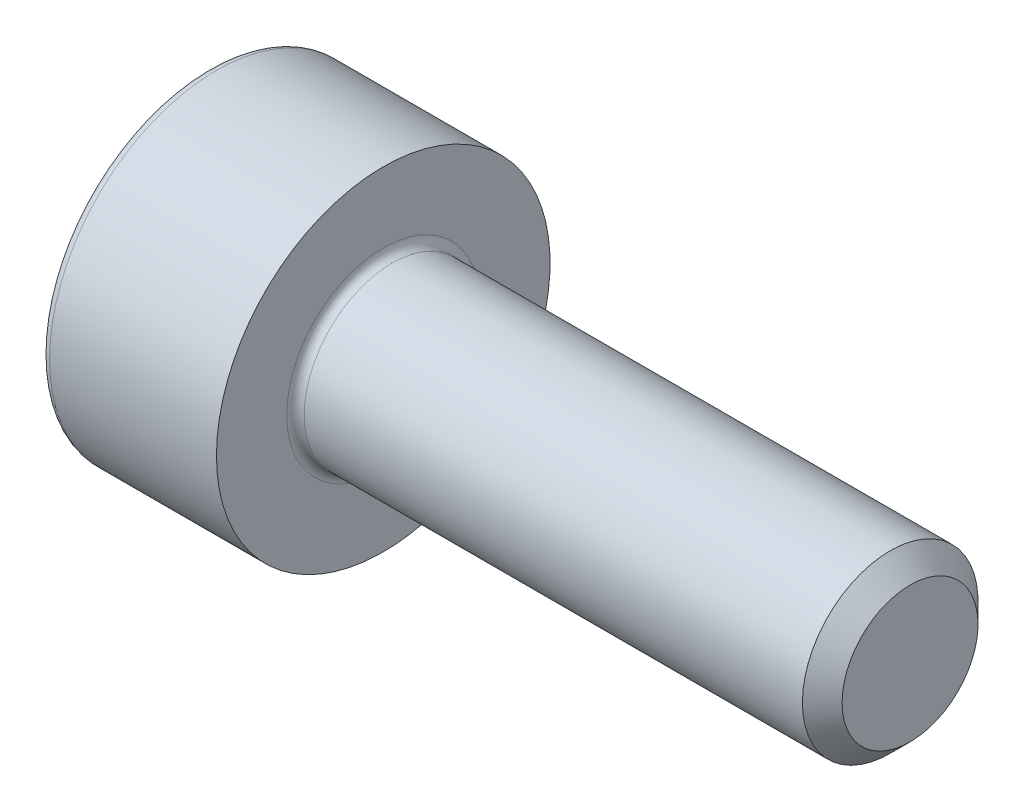
from build123d import *

# Parameters (mm, degrees)
FILLET1_R   = 0.1
FILLET2_R   = 0.1
HEX_2_DEPTH = 1


with BuildPart() as part:
    # BodySke → Base-Revolve (revolve)
    with BuildSketch(Plane.XY, mode=Mode.PRIVATE) as base_revolve_sk:
        Polygon((0, 0), (0, 1.9), (2, 1.9), (2, 1), (7.774, 1), (8, 0.774), (8, 0), align=None)
    revolve(base_revolve_sk.sketch.rotate(Axis((-31.75, 0, 0), (1, 0, 0)), 90), axis=Axis((-31.75, 0, 0), (1, 0, 0)))

    # Fillet1
    fillet1_edges = [part.edges().sort_by_distance(p)[0] for p in [
        (2, 0, -1),
    ]]
    fillet(fillet1_edges, radius=FILLET1_R)

    # Fillet2
    fillet2_edges = [part.edges().sort_by_distance(p)[0] for p in [
        (0, 0, -1.9),
    ]]
    fillet(fillet2_edges, radius=FILLET2_R)

    # Sketch2 → Hex-PreBroach (revolve, cut)
    with BuildSketch(Plane.XY, mode=Mode.PRIVATE) as hex_prebroach_sk:
        Polygon((0, 0.7725), (1, 0.7725), (1.446003083, 0), (0, 0), align=None)
    revolve(hex_prebroach_sk.sketch.rotate(Axis((0, 0, 0), (1, 0, 0)), 90), axis=Axis((0, 0, 0), (1, 0, 0)), mode=Mode.SUBTRACT)

    # Sketch3 → Hex 2 (cut)
    with BuildSketch(Plane(origin=(0, 0, 0), x_dir=(0, 0.500000000000001, 0.866025403784438), z_dir=(-1, 0, 0))):
        Polygon((0.446003083, 0.7725), (-0.446003083, 0.7725), (-0.892006166, 0), (-0.446003083, -0.7725), (0.446003083, -0.7725), (0.892006166, 0), align=None)
    extrude(amount=-HEX_2_DEPTH, mode=Mode.SUBTRACT)


solid = part.part
